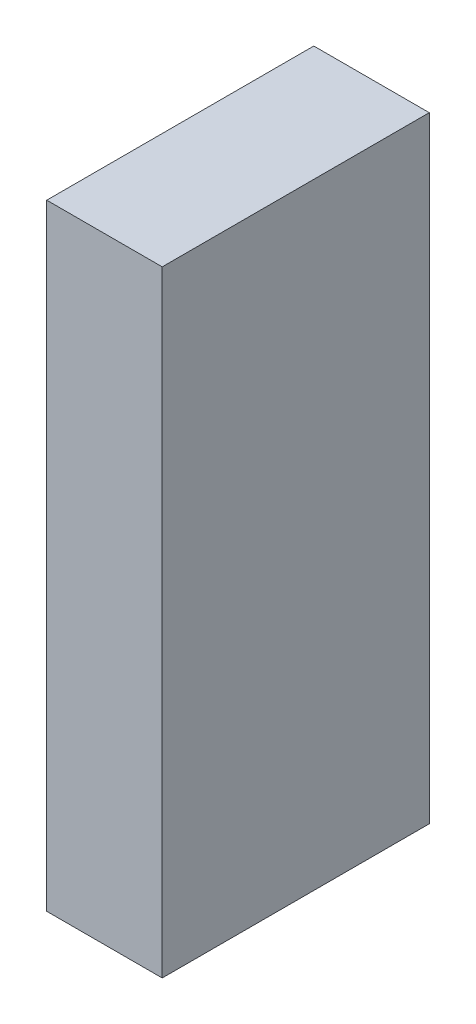
from build123d import *

# Parameters (mm, degrees)
SKETCH1_W           = 38.1
SKETCH1_H           = 88.10625
BOSS_EXTRUDE1_DEPTH = 203.2


with BuildPart() as part:
    # Sketch1 → Boss-Extrude1 (new body)
    with BuildSketch(Plane(origin=(0, 0, 0), x_dir=(1, 0, 0), z_dir=(0, 1, 0))):
        Rectangle(SKETCH1_W, SKETCH1_H)
    extrude(amount=BOSS_EXTRUDE1_DEPTH)


solid = part.part
